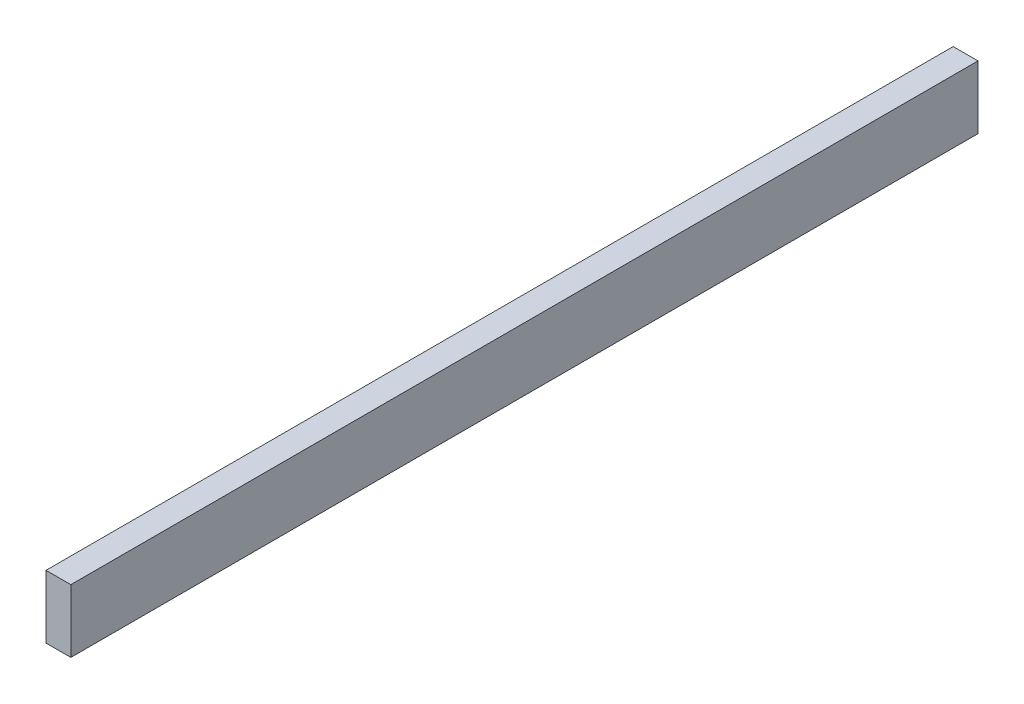
from build123d import *

# Parameters (mm, degrees)
SKETCH1_W           = 18
SKETCH1_H           = 45.72
BOSS_EXTRUDE1_DEPTH = 552
SKETCH2_W           = 18
SKETCH2_H           = 45.72
BOSS_EXTRUDE2_DEPTH = 106


with BuildPart() as part:
    # Sketch1 → Boss-Extrude1 (new body)
    with BuildSketch(Plane.XY):
        with Locations((9, 0)):
            Rectangle(SKETCH1_W, SKETCH1_H)
    extrude(amount=-BOSS_EXTRUDE1_DEPTH)

    # Sketch2 → Boss-Extrude2 (add)
    with BuildSketch(Plane(origin=(0, 0, -552), x_dir=(-1, 0, 0), z_dir=(0, 0, -1))):
        with Locations((-9, 0)):
            Rectangle(SKETCH2_W, SKETCH2_H)
    extrude(amount=BOSS_EXTRUDE2_DEPTH)


solid = part.part
